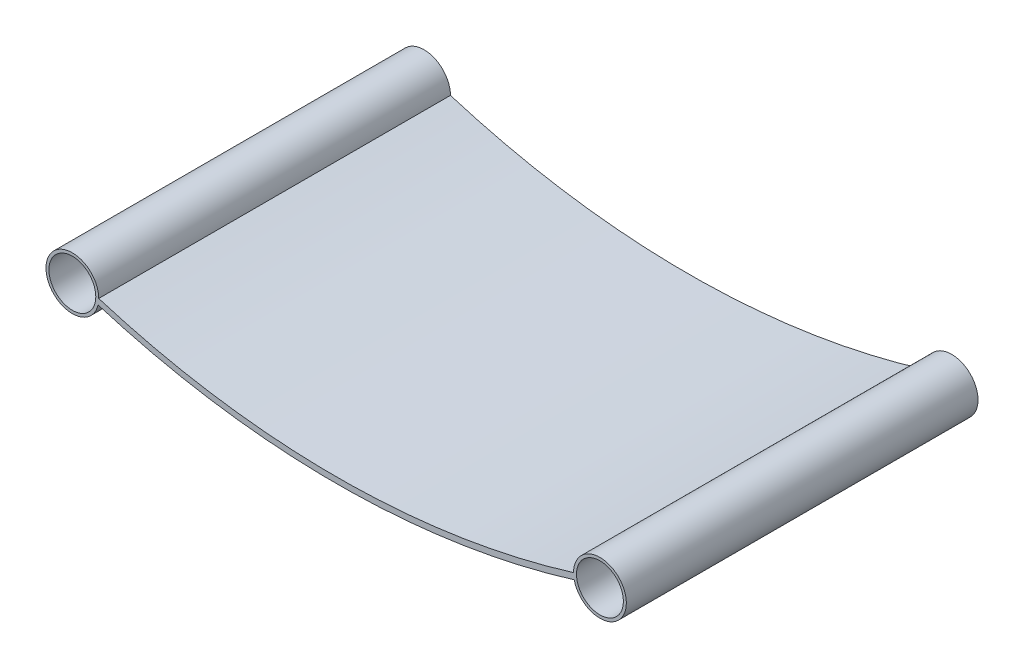
from build123d import *

# Parameters (mm, degrees)
SKETCH2_R             = 4.5
SKETCH2_R_2           = 4
BOSS_EXTRUDE1_DEPTH   = 60
BOSS_EXTRUDE1_2_DEPTH = 60
BOSS_EXTRUDE2_DEPTH   = 60


with BuildPart() as part:
    # Sketch2 → Boss-Extrude1 (new body)
    with BuildSketch(Plane.XY):
        with Locations((-45, 0)):
            Circle(SKETCH2_R)
        with Locations((-45, 0)):
            Circle(SKETCH2_R_2, mode=Mode.SUBTRACT)
    extrude(amount=-BOSS_EXTRUDE1_DEPTH)



with BuildPart() as body_2:
    # Sketch2 → Boss-Extrude1 2 (new body)
    with BuildSketch(Plane.XY):
        with Locations((45, 0)):
            Circle(SKETCH2_R)
        with Locations((45, 0)):
            Circle(SKETCH2_R_2, mode=Mode.SUBTRACT)
    extrude(amount=-BOSS_EXTRUDE1_2_DEPTH)


with BuildPart() as part_1:
    add(part.part)

    add(body_2.part)  # Boss-Extrude2 merges body 2
    # Sketch3 → Boss-Extrude2 (add)
    with BuildSketch(Plane.XY):
        with BuildLine():
            Line((40.5, 0), (40.793767043, -0.955877045))
            ThreePointArc((40.793767043, -0.955877045), (0, -7.082982188), (-40.793767043, -0.955877045))
            Line((-40.793767043, -0.955877045), (-40.5, 0))
            ThreePointArc((-40.5, 0), (0, -6.082982188), (40.5, 0))
        make_face()
    extrude(amount=-BOSS_EXTRUDE2_DEPTH)


solid = part_1.part
